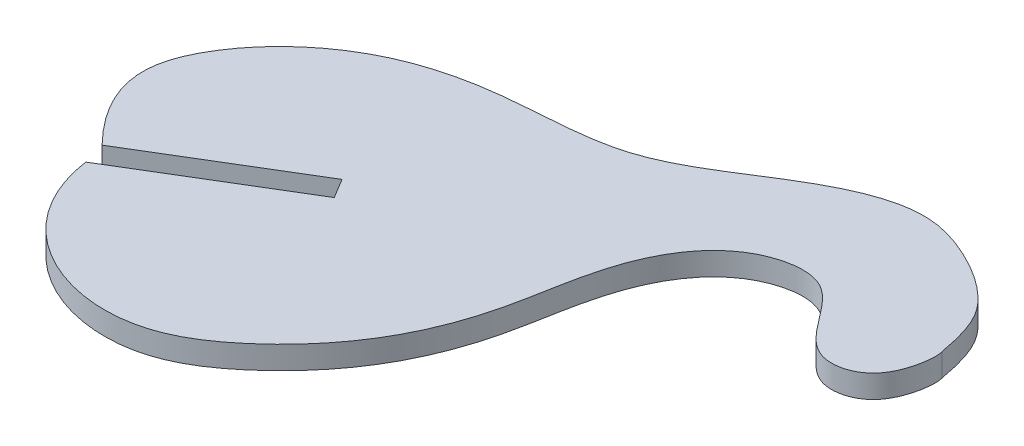
from build123d import *

# Parameters (mm, degrees)
EXTRUDE_1_DEPTH = 4


with BuildPart() as part:
    # Эскиз1 → Бобышка-Вытянуть1 (new body)
    with BuildSketch(Plane(origin=(0, 0, 0), x_dir=(1, 0, 0), z_dir=(0, 1, 0))):
        with BuildLine():
            Line((59.351976898, 27.492116897), (85.47431353, 43.242506303))
            Line((85.47431353, 43.242506303), (87.539714982, 39.816996583))
            Line((87.539714982, 39.816996583), (60.488577547, 23.506589345))
            add(Edge.make_bspline(
                [(163.826427387, 69.602217713), (164.350326554, 68.247306073), (163.280356213, 59.522708221), (150.477837292, 56.120517567), (146.093483495, 71.422105578), (130.002070287, 68.663056602), (121.098616767, 55.020799634), (119.803810225, 38.604953487), (113.65717575, 22.560279167), (104.110411774, 11.08577814), (84.567519584, -2.357604583), (62.895902113, 6.921116662), (60.488577547, 23.506589345)],
                knots=[0, 0, 0, 0, 0.056552715, 0.104069879, 0.202495964, 0.261977507, 0.363177379, 0.483727176, 0.568901478, 0.679995023, 0.759058655, 1, 1, 1, 1], degree=3))
            add(Edge.make_bspline(
                [(163.826427387, 69.602217713), (162.712049588, 76.05900402), (159.44972859, 81.223253645), (151.425014845, 86.34120513), (141.526903834, 89.626260013), (125.411823952, 84.442552935), (109.674416259, 70.114050593), (87.086939692, 70.758737467), (67.981802079, 65.851858467), (52.25940893, 51.785237476), (49.56517022, 37.520925148), (59.351976898, 27.492116897)],
                knots=[0, 0, 0, 0, 0.062136962, 0.129358077, 0.186341705, 0.26991696, 0.458076549, 0.600563621, 0.712354201, 0.857805146, 1, 1, 1, 1], degree=3))
        make_face()
    extrude(amount=EXTRUDE_1_DEPTH)


solid = part.part
